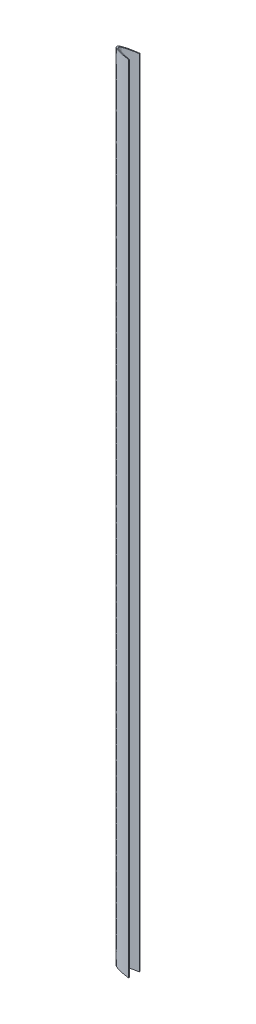
from build123d import *

# Parameters (mm, degrees)
BOSS_EXTRUDE1_DEPTH = 2000


with BuildPart() as part:
    # Sketch1 → Boss-Extrude1 (new body)
    with BuildSketch(Plane(origin=(0, 0, 0), x_dir=(1, 0, 0), z_dir=(0, 1, 0))):
        with BuildLine():
            add(Edge.make_bspline(
                [(13.961091615, -5.154302653), (15.182348299, -5.711234946), (17.900991537, -6.801086647), (22.176923973, -8.183114332), (28.187813822, -9.853116127), (35.719736123, -11.518136011), (44.323179203, -12.96949091), (49.909085455, -13.718183646), (52.469352209, -14.025338944)],
                knots=[0.521036484, 0.521036484, 0.521036484, 0.521036484, 0.531842873, 0.544621418, 0.557222081, 0.582102357, 0.606730238, 0.627506664, 0.627506664, 0.627506664, 0.627506664], degree=3))
            Line((52.469352209, -14.025338944), (52.659881913, -12.5396462))
            ThreePointArc((52.659881913, -12.5396462), (33.963405011, -8.918048076), (15.618064782, -3.807009689))
            ThreePointArc((15.618064782, -3.807009689), (12.845532593, 0), (15.618064782, 3.807009689))
            ThreePointArc((15.618064782, 3.807009689), (33.957463045, 8.916647173), (52.647811414, 12.537807438))
            Line((52.647811414, 12.537807438), (52.469352225, 14.025338751))
            add(Edge.make_bspline(
                [(52.469352225, 14.025338751), (49.909085459, 13.718183448), (44.323179196, 12.969490702), (35.719736106, 11.518135789), (28.187813808, 9.853115894), (22.176923961, 8.183114091), (17.900991563, 6.801086411), (15.18234836, 5.711234722), (13.96109171, 5.154302446)],
                knots=[0.372496645, 0.372496645, 0.372496645, 0.372496645, 0.393273071, 0.417900952, 0.442781229, 0.455381891, 0.468160436, 0.478966825, 0.478966825, 0.478966825, 0.478966825], degree=3))
            add(Edge.make_bspline(
                [(13.96109171, 5.154302446), (13.695827558, 5.033333469), (12.650642641, 4.543869266), (11.288134652, 3.833255806), (10.118778737, 2.963378897), (9.381822376, 2.249568557), (8.799995112, 1.30911098), (8.574565954, -1.31e-07), (8.799995114, -1.309111242), (9.381822379, -2.249568817), (10.118778742, -2.963379156), (11.288134658, -3.833256063), (12.650642614, -4.543869504), (13.695827498, -5.033333691), (13.961091615, -5.154302653)],
                knots=[0.478966825, 0.478966825, 0.478966825, 0.478966825, 0.481314037, 0.488255538, 0.491307545, 0.493017231, 0.496509377, 0.500001655, 0.503493932, 0.506986078, 0.508695764, 0.511747772, 0.518689273, 0.521036484, 0.521036484, 0.521036484, 0.521036484], degree=3))
        make_face()
    extrude(amount=BOSS_EXTRUDE1_DEPTH)


solid = part.part
